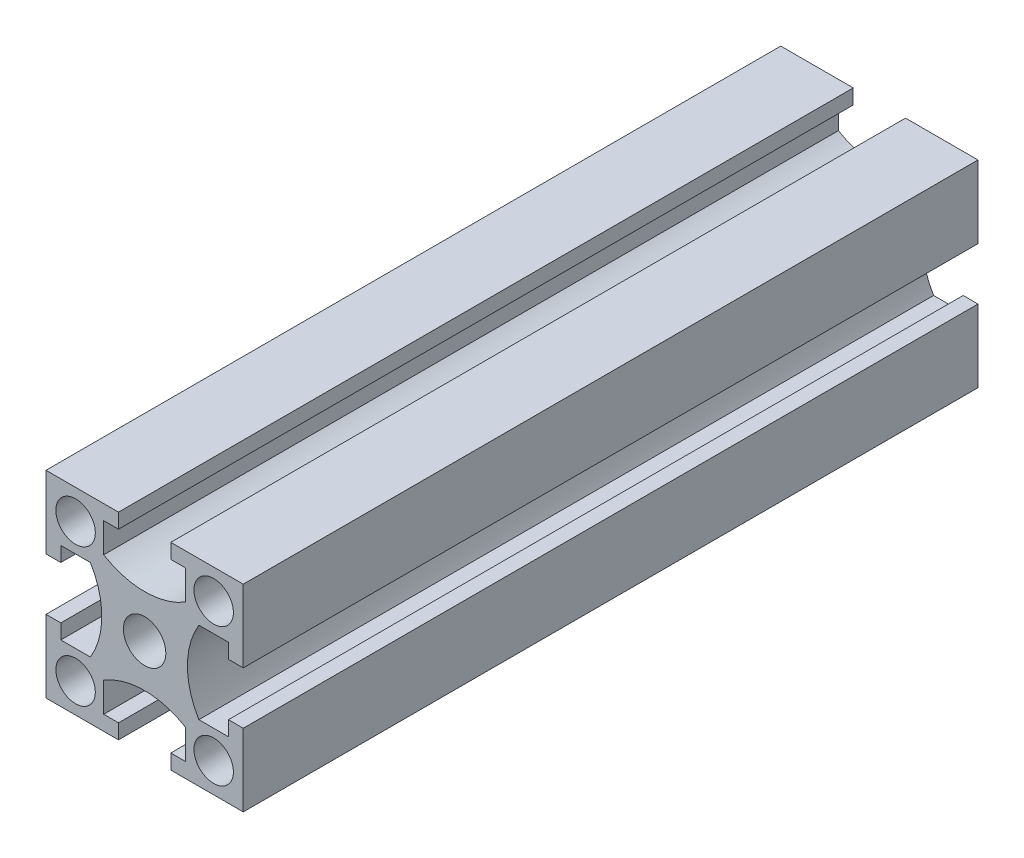
from build123d import *

# Parameters (mm, degrees)
SKETCH_1_W          = 20
SKETCH_1_H          = 20
EXTRUDE_1_DEPTH     = 74.5
SKETCH_2_R          = 2.15
SKETCH_2_R_2        = 2
CUT_EXTRUDE_1_DEPTH = 315.5


with BuildPart() as part:
    # 스케치1 → 보스-돌출1 (new body)
    with BuildSketch(Plane.XY):
        Rectangle(SKETCH_1_W, SKETCH_1_H)
    extrude(amount=EXTRUDE_1_DEPTH)

    # 스케치2 → 컷-돌출1 (cut)
    with BuildSketch(Plane.XY.offset(74.5)):
        Circle(SKETCH_2_R)
        with Locations((-7, 7)):
            Circle(SKETCH_2_R_2)
        with Locations((7, 7)):
            Circle(SKETCH_2_R_2)
        with Locations((7, -7)):
            Circle(SKETCH_2_R_2)
        with Locations((-7, -7)):
            Circle(SKETCH_2_R_2)
        with BuildLine():
            Line((-2.65, 10), (-2.65, 8.5))
            Line((-2.65, 8.5), (-4.15, 8.5))
            Line((-4.15, 8.5), (-4.15, 5.5))
            ThreePointArc((-4.15, 5.5), (0, 4.339407869), (4.15, 5.5))
            Line((4.15, 5.5), (4.15, 8.5))
            Line((4.15, 8.5), (2.65, 8.5))
            Line((2.65, 8.5), (2.65, 10))
            Line((2.65, 10), (-2.65, 10))
        make_face()
        with BuildLine():
            Line((10, 2.65), (8.5, 2.65))
            Line((8.5, 2.65), (8.5, 4.15))
            Line((8.5, 4.15), (5.5, 4.15))
            ThreePointArc((5.5, 4.15), (4.339407869, 0), (5.5, -4.15))
            Line((5.5, -4.15), (8.5, -4.15))
            Line((8.5, -4.15), (8.5, -2.65))
            Line((8.5, -2.65), (10, -2.65))
            Line((10, -2.65), (10, 2.65))
        make_face()
        with BuildLine():
            Line((2.65, -10), (2.65, -8.5))
            Line((2.65, -8.5), (4.15, -8.5))
            Line((4.15, -8.5), (4.15, -5.5))
            ThreePointArc((4.15, -5.5), (0, -4.339407869), (-4.15, -5.5))
            Line((-4.15, -5.5), (-4.15, -8.5))
            Line((-4.15, -8.5), (-2.65, -8.5))
            Line((-2.65, -8.5), (-2.65, -10))
            Line((-2.65, -10), (2.65, -10))
        make_face()
        with BuildLine():
            Line((-10, -2.65), (-8.5, -2.65))
            Line((-8.5, -2.65), (-8.5, -4.15))
            Line((-8.5, -4.15), (-5.5, -4.15))
            ThreePointArc((-5.5, -4.15), (-4.339407869, 0), (-5.5, 4.15))
            Line((-5.5, 4.15), (-8.5, 4.15))
            Line((-8.5, 4.15), (-8.5, 2.65))
            Line((-8.5, 2.65), (-10, 2.65))
            Line((-10, 2.65), (-10, -2.65))
        make_face()
    extrude(amount=-CUT_EXTRUDE_1_DEPTH, mode=Mode.SUBTRACT)


solid = part.part
